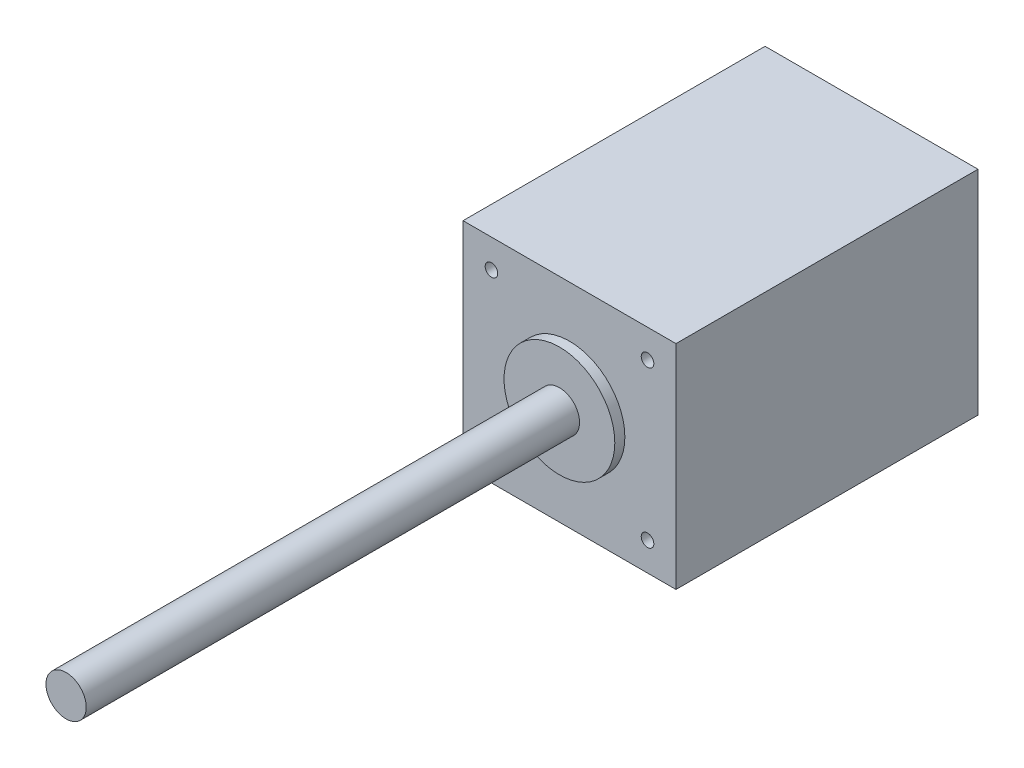
from build123d import *

# Parameters (mm, degrees)
SKETCH_1_W         = 42.3
SKETCH_1_H         = 42.3
EXTRUDE_1_DEPTH    = 60
SKETCH_2_R         = 11
EXTRUDE_2_DEPTH    = 2
SKETCH_3_R         = 4
EXTRUDE_3_DEPTH    = 98
HOLE_WIZARD_M3_1_D = 2.5


with BuildPart() as part:
    # 草图1 → 凸台-拉伸1 (new body)
    with BuildSketch(Plane.XY):
        Rectangle(SKETCH_1_W, SKETCH_1_H)
    extrude(amount=EXTRUDE_1_DEPTH)

    # 草图2 → 凸台-拉伸2 (add)
    with BuildSketch(Plane.XY.offset(60)):
        Circle(SKETCH_2_R)
    extrude(amount=EXTRUDE_2_DEPTH)

    # 草图3 → 凸台-拉伸3 (add)
    with BuildSketch(Plane.XY.offset(62)):
        Circle(SKETCH_3_R)
    extrude(amount=EXTRUDE_3_DEPTH)

    # M3 螺纹孔1 (through all)
    with Locations(Plane.XY.offset(60)):
        with Locations((-15.5, 15.5), (15.5, 15.5), (15.5, -15.5), (-15.5, -15.5)):
            Hole(HOLE_WIZARD_M3_1_D / 2)


solid = part.part
